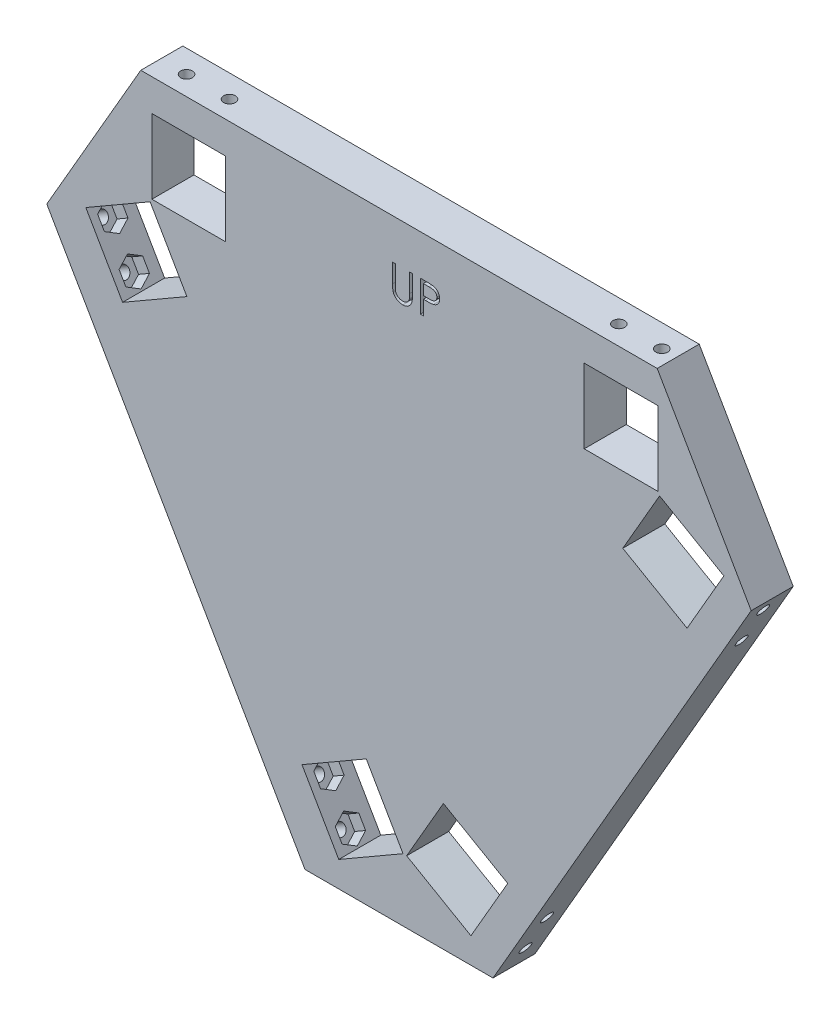
from build123d import *

# Parameters (mm, degrees)
RESSALTO_EXTRUS_O1_DEPTH = 10
ESBO_O2_R                = 1.4
CORTE_EXTRUS_O1_DEPTH    = 25
CORTE_EXTRUS_O2_START    = -7
ESBO_O2_4_R              = 1.4
CORTE_EXTRUS_O2_DEPTH    = 3
CORTE_EXTRUS_O4_START    = -10
ESBO_O2_6_W              = 10
ESBO_O2_6_H              = 7.5
ESBO_O2_6_R              = 1.4
ESBO_O2_6_H_2            = 2.5
CORTE_EXTRUS_O4_DEPTH    = 17.66
PADR_OCIRCULAR6_COUNT    = 3
CORTE_EXTRUS_O5_DEPTH    = 2


with BuildPart() as part:
    # Esboço1 → Ressalto-extrusão1 (new body)
    with BuildSketch(Plane.XY):
        Polygon((78.784620241, 13.891854213), (51.423008775, 61.28355545), (-51.423008775, 61.28355545), (-78.784620241, 13.891854213), (-27.361611466, -75.175409663), (27.361611466, -75.175409663), align=None)
        Polygon((-51.423008775, 61.28355545), (-61.423008775, 61.28355545), (-83.784620241, 22.552108251), (-78.784620241, 13.891854213), align=None)
        Polygon((78.784620241, 13.891854213), (51.423008775, 61.28355545), (61.423008775, 61.28355545), (83.784620241, 22.552108251), align=None)
        Polygon((-27.361611466, -75.175409663), (27.361611466, -75.175409663), (22.361611466, -83.835663701), (-22.361611466, -83.835663701), align=None)
    extrude(amount=RESSALTO_EXTRUS_O1_DEPTH)

    # Esboço2 → Corte-extrusão1 (cut)
    with BuildSketch(Plane(origin=(-53.073115854, -30.641777725, 0), x_dir=(0, 0, 1), z_dir=(-0.8660254037844384, -0.5000000000000006, 0))):
        with Locations(Location((5.4, 56.533008775, 0), (0, 0, 270))):
            Circle(ESBO_O2_R)
        with Locations(Location((5.4, 46.313008775, 0), (0, 0, 270))):
            Circle(ESBO_O2_R)
        with Locations(Location((5.4, -46.313008775, 0), (0, 0, 270))):
            Circle(ESBO_O2_R)
        with Locations(Location((5.4, -56.533008775, 0), (0, 0, 270))):
            Circle(ESBO_O2_R)
    corte_extrus_o1 = extrude(amount=-CORTE_EXTRUS_O1_DEPTH, mode=Mode.SUBTRACT)

    # Esboço2<4> → Corte-extrusão2 (cut)
    # profile 1 of 8: a face of its own
    with BuildSketch(Plane(origin=(-53.073115854, -30.641777725, 0), x_dir=(0, 0, 1), z_dir=(-0.8660254037844384, -0.5000000000000006, 0)).offset(CORTE_EXTRUS_O2_START)):
        Polygon((5.4, 53.299847267), (8.2, 54.916428021), (8.2, 58.149589529), (5.4, 59.766170282), (2.6, 58.149589529), (2.6, 54.916428021), align=None)
        with Locations(Location((5.4, 56.533008775, 0), (0, 0, 270))):
            Circle(ESBO_O2_4_R, mode=Mode.SUBTRACT)
    # profile 2 of 8: a face of its own
    with BuildSketch(Plane(origin=(-53.073115854, -30.641777725, 0), x_dir=(0, 0, 1), z_dir=(-0.8660254037844384, -0.5000000000000006, 0)).offset(CORTE_EXTRUS_O2_START)):
        Polygon((8.2, 44.696428021), (5.4, 43.079847267), (2.6, 44.696428021), (2.6, 47.929589529), (5.4, 49.546170282), (8.2, 47.929589529), align=None)
        with Locations(Location((5.4, 46.313008775, 0), (0, 0, 270))):
            Circle(ESBO_O2_4_R, mode=Mode.SUBTRACT)
    # profile 3 of 8: a face of its own
    with BuildSketch(Plane(origin=(-53.073115854, -30.641777725, 0), x_dir=(0, 0, 1), z_dir=(-0.8660254037844384, -0.5000000000000006, 0)).offset(CORTE_EXTRUS_O2_START)):
        Polygon((5.4, -49.546170282), (8.2, -47.929589529), (8.2, -44.696428021), (5.4, -43.079847267), (2.6, -44.696428021), (2.6, -47.929589529), align=None)
        with Locations(Location((5.4, -46.313008775, 0), (0, 0, 270))):
            Circle(ESBO_O2_4_R, mode=Mode.SUBTRACT)
    # profile 4 of 8: a face of its own
    with BuildSketch(Plane(origin=(-53.073115854, -30.641777725, 0), x_dir=(0, 0, 1), z_dir=(-0.8660254037844384, -0.5000000000000006, 0)).offset(CORTE_EXTRUS_O2_START)):
        with Locations(Location((5.4, -46.313008775, 0), (0, 0, 270))):
            Circle(ESBO_O2_4_R)
    # profile 5 of 8: a face of its own
    with BuildSketch(Plane(origin=(-53.073115854, -30.641777725, 0), x_dir=(0, 0, 1), z_dir=(-0.8660254037844384, -0.5000000000000006, 0)).offset(CORTE_EXTRUS_O2_START)):
        Polygon((8.2, -58.149589529), (5.4, -59.766170282), (2.6, -58.149589529), (2.6, -54.916428021), (5.4, -53.299847267), (8.2, -54.916428021), align=None)
        with Locations(Location((5.4, -56.533008775, 0), (0, 0, 270))):
            Circle(ESBO_O2_4_R, mode=Mode.SUBTRACT)
    # profile 6 of 8: a face of its own
    with BuildSketch(Plane(origin=(-53.073115854, -30.641777725, 0), x_dir=(0, 0, 1), z_dir=(-0.8660254037844384, -0.5000000000000006, 0)).offset(CORTE_EXTRUS_O2_START)):
        with Locations(Location((5.4, -56.533008775, 0), (0, 0, 270))):
            Circle(ESBO_O2_4_R)
    # profile 7 of 8: a face of its own
    with BuildSketch(Plane(origin=(-53.073115854, -30.641777725, 0), x_dir=(0, 0, 1), z_dir=(-0.8660254037844384, -0.5000000000000006, 0)).offset(CORTE_EXTRUS_O2_START)):
        with Locations(Location((5.4, 56.533008775, 0), (0, 0, 270))):
            Circle(ESBO_O2_4_R)
    # profile 8 of 8: a face of its own
    with BuildSketch(Plane(origin=(-53.073115854, -30.641777725, 0), x_dir=(0, 0, 1), z_dir=(-0.8660254037844384, -0.5000000000000006, 0)).offset(CORTE_EXTRUS_O2_START)):
        with Locations(Location((5.4, 46.313008775, 0), (0, 0, 270))):
            Circle(ESBO_O2_4_R)
    corte_extrus_o2 = extrude(amount=-CORTE_EXTRUS_O2_DEPTH, mode=Mode.SUBTRACT)

    # Esboço2<6> → Corte-extrusão4 (cut)
    # profile 1 of 14: a face of its own
    with BuildSketch(Plane(origin=(-53.073115854, -30.641777725, 0), x_dir=(0, 0, 1), z_dir=(-0.8660254037844384, -0.5000000000000006, 0)).offset(CORTE_EXTRUS_O4_START)):
        with Locations((5, 56.423008775)):
            Rectangle(ESBO_O2_6_W, ESBO_O2_6_H)
        Polygon((5.4, 59.766170282), (8.2, 58.149589529), (8.2, 54.916428021), (5.4, 53.299847267), (2.6, 54.916428021), (2.6, 58.149589529), align=None, mode=Mode.SUBTRACT)
    # profile 2 of 14: a face of its own
    with BuildSketch(Plane(origin=(-53.073115854, -30.641777725, 0), x_dir=(0, 0, 1), z_dir=(-0.8660254037844384, -0.5000000000000006, 0)).offset(CORTE_EXTRUS_O4_START)):
        with Locations((5, 46.423008775)):
            Rectangle(ESBO_O2_6_W, ESBO_O2_6_H)
        Polygon((5.4, 49.546170282), (8.2, 47.929589529), (8.2, 44.696428021), (5.4, 43.079847267), (2.6, 44.696428021), (2.6, 47.929589529), align=None, mode=Mode.SUBTRACT)
    # profile 3 of 14: a face of its own
    with BuildSketch(Plane(origin=(-53.073115854, -30.641777725, 0), x_dir=(0, 0, 1), z_dir=(-0.8660254037844384, -0.5000000000000006, 0)).offset(CORTE_EXTRUS_O4_START)):
        Polygon((5.4, 53.299847267), (8.2, 54.916428021), (8.2, 58.149589529), (5.4, 59.766170282), (2.6, 58.149589529), (2.6, 54.916428021), align=None)
        with Locations(Location((5.4, 56.533008775, 0), (0, 0, 270))):
            Circle(ESBO_O2_6_R, mode=Mode.SUBTRACT)
    # profile 4 of 14: a face of its own
    with BuildSketch(Plane(origin=(-53.073115854, -30.641777725, 0), x_dir=(0, 0, 1), z_dir=(-0.8660254037844384, -0.5000000000000006, 0)).offset(CORTE_EXTRUS_O4_START)):
        Polygon((8.2, 44.696428021), (5.4, 43.079847267), (2.6, 44.696428021), (2.6, 47.929589529), (5.4, 49.546170282), (8.2, 47.929589529), align=None)
        with Locations(Location((5.4, 46.313008775, 0), (0, 0, 270))):
            Circle(ESBO_O2_6_R, mode=Mode.SUBTRACT)
    # profile 5 of 14: a face of its own
    with BuildSketch(Plane(origin=(-53.073115854, -30.641777725, 0), x_dir=(0, 0, 1), z_dir=(-0.8660254037844384, -0.5000000000000006, 0)).offset(CORTE_EXTRUS_O4_START)):
        with Locations(Location((5.4, 46.313008775, 0), (0, 0, 270))):
            Circle(ESBO_O2_6_R)
    # profile 6 of 14: a face of its own
    with BuildSketch(Plane(origin=(-53.073115854, -30.641777725, 0), x_dir=(0, 0, 1), z_dir=(-0.8660254037844384, -0.5000000000000006, 0)).offset(CORTE_EXTRUS_O4_START)):
        with Locations(Location((5.4, 56.533008775, 0), (0, 0, 270))):
            Circle(ESBO_O2_6_R)
    # profile 7 of 14: a face of its own
    with BuildSketch(Plane(origin=(-53.073115854, -30.641777725, 0), x_dir=(0, 0, 1), z_dir=(-0.8660254037844384, -0.5000000000000006, 0)).offset(CORTE_EXTRUS_O4_START)):
        with Locations((5, -46.423008775)):
            Rectangle(ESBO_O2_6_W, ESBO_O2_6_H)
        Polygon((5.4, -43.079847267), (8.2, -44.696428021), (8.2, -47.929589529), (5.4, -49.546170282), (2.6, -47.929589529), (2.6, -44.696428021), align=None, mode=Mode.SUBTRACT)
    # profile 8 of 14: a face of its own
    with BuildSketch(Plane(origin=(-53.073115854, -30.641777725, 0), x_dir=(0, 0, 1), z_dir=(-0.8660254037844384, -0.5000000000000006, 0)).offset(CORTE_EXTRUS_O4_START)):
        Polygon((5.4, -49.546170282), (8.2, -47.929589529), (8.2, -44.696428021), (5.4, -43.079847267), (2.6, -44.696428021), (2.6, -47.929589529), align=None)
        with Locations(Location((5.4, -46.313008775, 0), (0, 0, 270))):
            Circle(ESBO_O2_6_R, mode=Mode.SUBTRACT)
    # profile 9 of 14: a face of its own
    with BuildSketch(Plane(origin=(-53.073115854, -30.641777725, 0), x_dir=(0, 0, 1), z_dir=(-0.8660254037844384, -0.5000000000000006, 0)).offset(CORTE_EXTRUS_O4_START)):
        with Locations(Location((5.4, -46.313008775, 0), (0, 0, 270))):
            Circle(ESBO_O2_6_R)
    # profile 10 of 14: a face of its own
    with BuildSketch(Plane(origin=(-53.073115854, -30.641777725, 0), x_dir=(0, 0, 1), z_dir=(-0.8660254037844384, -0.5000000000000006, 0)).offset(CORTE_EXTRUS_O4_START)):
        with Locations((5, -56.423008775)):
            Rectangle(ESBO_O2_6_W, ESBO_O2_6_H)
        Polygon((5.4, -53.299847267), (8.2, -54.916428021), (8.2, -58.149589529), (5.4, -59.766170282), (2.6, -58.149589529), (2.6, -54.916428021), align=None, mode=Mode.SUBTRACT)
    # profile 11 of 14: a face of its own
    with BuildSketch(Plane(origin=(-53.073115854, -30.641777725, 0), x_dir=(0, 0, 1), z_dir=(-0.8660254037844384, -0.5000000000000006, 0)).offset(CORTE_EXTRUS_O4_START)):
        Polygon((8.2, -58.149589529), (5.4, -59.766170282), (2.6, -58.149589529), (2.6, -54.916428021), (5.4, -53.299847267), (8.2, -54.916428021), align=None)
        with Locations(Location((5.4, -56.533008775, 0), (0, 0, 270))):
            Circle(ESBO_O2_6_R, mode=Mode.SUBTRACT)
    # profile 12 of 14: a face of its own
    with BuildSketch(Plane(origin=(-53.073115854, -30.641777725, 0), x_dir=(0, 0, 1), z_dir=(-0.8660254037844384, -0.5000000000000006, 0)).offset(CORTE_EXTRUS_O4_START)):
        with Locations(Location((5.4, -56.533008775, 0), (0, 0, 270))):
            Circle(ESBO_O2_6_R)
    # profile 13 of 14: a face of its own
    with BuildSketch(Plane(origin=(-53.073115854, -30.641777725, 0), x_dir=(0, 0, 1), z_dir=(-0.8660254037844384, -0.5000000000000006, 0)).offset(CORTE_EXTRUS_O4_START)):
        with Locations((5, 51.423008775)):
            Rectangle(ESBO_O2_6_W, ESBO_O2_6_H_2)
    # profile 14 of 14: a face of its own
    with BuildSketch(Plane(origin=(-53.073115854, -30.641777725, 0), x_dir=(0, 0, 1), z_dir=(-0.8660254037844384, -0.5000000000000006, 0)).offset(CORTE_EXTRUS_O4_START)):
        with Locations((5, -51.423008775)):
            Rectangle(ESBO_O2_6_W, ESBO_O2_6_H_2)
    corte_extrus_o4 = extrude(amount=-CORTE_EXTRUS_O4_DEPTH, mode=Mode.SUBTRACT)

    # PadrãoCircular6: Corte-extrusão1, Corte-extrusão2, Corte-extrusão4 ×3 about axis
    padr_ocircular6_axis = Axis((1.394284729, 0.804990664, 0), (0, 0, 1))
    add([corte_extrus_o1.rotate(padr_ocircular6_axis, i * 360 / PADR_OCIRCULAR6_COUNT) for i in range(1, PADR_OCIRCULAR6_COUNT)], mode=Mode.SUBTRACT)
    add([corte_extrus_o2.rotate(padr_ocircular6_axis, i * 360 / PADR_OCIRCULAR6_COUNT) for i in range(1, PADR_OCIRCULAR6_COUNT)], mode=Mode.SUBTRACT)
    add([corte_extrus_o4.rotate(padr_ocircular6_axis, i * 360 / PADR_OCIRCULAR6_COUNT) for i in range(1, PADR_OCIRCULAR6_COUNT)], mode=Mode.SUBTRACT)

    # Esboço3 → Corte-extrusão5 (cut)
    # profile 1 of 2: a face of its own
    with BuildSketch(Plane.XY.offset(10)):
        with BuildLine():
            Line((-1.52797783, 51.712311165), (-0.863127403, 51.712311165))
            Line((-0.863127403, 51.712311165), (-0.863127403, 47.273544138))
            add(Edge.make_bspline(
                [(-0.863127403, 47.273544138), (-0.863226344, 47.210719914), (-0.863414103, 47.091500122), (-0.862159948, 46.921810553), (-0.858647619, 46.770950515), (-0.856433248, 46.638338496), (-0.851507058, 46.524583014), (-0.847489526, 46.429067773), (-0.842323681, 46.352245044), (-0.836115249, 46.307412084), (-0.83344658, 46.288140826)],
                knots=[0, 0, 0, 0, 1.528628734, 2.90083645, 4.128790002, 5.200304208, 6.127813768, 6.898992206, 7.526736466, 8, 8, 8, 8], degree=3))
            add(Edge.make_bspline(
                [(-0.83344658, 46.288140826), (-0.822487626, 46.218615177), (-0.801187215, 46.0834814), (-0.746902382, 45.89105887), (-0.671088671, 45.717637284), (-0.581250898, 45.557805051), (-0.462860204, 45.416010905), (-0.321036054, 45.285387907), (-0.149209777, 45.171147587), (0.041841838, 45.066688369), (0.247762258, 44.982730611), (0.458182771, 44.919244657), (0.669940411, 44.880554319), (0.811706627, 44.876074311), (0.882104969, 44.873849627)],
                knots=[0, 0, 0, 0, 1.035780045, 2.013197591, 2.933192213, 3.817615948, 4.702609284, 5.640816605, 6.646850145, 7.73207398, 8.84249596, 9.914020372, 10.964143139, 12, 12, 12, 12], degree=3))
            add(Edge.make_bspline(
                [(0.882104969, 44.873849627), (0.942543719, 44.87612261), (1.063072142, 44.880655448), (1.242155754, 44.908725477), (1.416569317, 44.959315008), (1.587174089, 45.024592496), (1.74709034, 45.110841564), (1.896407292, 45.210474841), (2.029680953, 45.327337862), (2.151300382, 45.456666924), (2.257207662, 45.602589501), (2.349009912, 45.761928227), (2.424206463, 45.937081011), (2.461340257, 46.060174538), (2.480417268, 46.12341226)],
                knots=[0, 0, 0, 0, 0.994687771, 1.983630487, 2.973142513, 3.978332533, 4.983357753, 5.956394766, 6.925816176, 7.893390482, 8.871859704, 9.88551698, 10.913711441, 12, 12, 12, 12], degree=3))
            add(Edge.make_bspline(
                [(2.480417268, 46.12341226), (2.486767534, 46.149550076), (2.500918484, 46.207795663), (2.514141396, 46.306265728), (2.527913541, 46.422448215), (2.537469381, 46.557177885), (2.546785297, 46.710003277), (2.552358635, 46.881720522), (2.554934688, 47.071706089), (2.555702361, 47.204288082), (2.556103366, 47.273544138)],
                knots=[0, 0, 0, 0, 0.558680831, 1.244966039, 2.062412453, 2.990489873, 4.051219941, 5.244515665, 6.560634259, 8, 8, 8, 8], degree=3))
            Line((2.556103366, 47.273544138), (2.556103366, 51.712311165))
            Line((2.556103366, 51.712311165), (3.220953794, 51.712311165))
            Line((3.220953794, 51.712311165), (3.220953794, 47.237927151))
            add(Edge.make_bspline(
                [(3.220953794, 47.237927151), (3.220415905, 47.157285582), (3.219366184, 46.999908658), (3.210263297, 46.769294948), (3.195749314, 46.550531137), (3.175242861, 46.343587819), (3.148071205, 46.149205516), (3.117855321, 45.965680423), (3.079375309, 45.794329922), (3.034431277, 45.633817971), (2.983052267, 45.481025301), (2.916501836, 45.3360154), (2.841519978, 45.194379921), (2.752588963, 45.058261091), (2.652658203, 44.92705622), (2.539518812, 44.801561011), (2.416912671, 44.67977003), (2.282801604, 44.564807373), (2.139396325, 44.459379007), (1.987123415, 44.366673725), (1.827152585, 44.288307068), (1.659899668, 44.223799694), (1.485293289, 44.175297126), (1.303329044, 44.139154713), (1.113592752, 44.118618183), (0.984550896, 44.115566098), (0.919205997, 44.114020567)],
                knots=[0, 0, 0, 0, 1.316592851, 2.569410997, 3.76748051, 4.895814652, 5.963796859, 6.97159953, 7.931736103, 8.829262218, 9.692595152, 10.560224239, 11.431080259, 12.30701507, 13.211635791, 14.121146779, 15.063487852, 16.031507147, 17.00238618, 17.966455255, 18.938106653, 19.907068911, 20.888905087, 21.893141452, 22.933117798, 24, 24, 24, 24], degree=3))
            add(Edge.make_bspline(
                [(0.919205997, 44.114020567), (0.84793973, 44.115681653), (0.708115569, 44.118940699), (0.502083326, 44.13761552), (0.304568277, 44.172791121), (0.113484338, 44.217579669), (-0.068566981, 44.279351913), (-0.244024772, 44.351526277), (-0.40988398, 44.440166478), (-0.568835336, 44.53878916), (-0.71663107, 44.649754644), (-0.852303906, 44.770701346), (-0.976077832, 44.899691811), (-1.085866573, 45.038122585), (-1.183489112, 45.184917032), (-1.26758473, 45.340490423), (-1.339791097, 45.504782525), (-1.377058331, 45.618983466), (-1.39589817, 45.676715879)],
                knots=[0, 0, 0, 0, 1.13879206, 2.234305948, 3.301075583, 4.341971843, 5.366689343, 6.369221514, 7.369726634, 8.367512178, 9.355451585, 10.318319045, 11.268648973, 12.207971039, 13.137398894, 14.081662264, 15.030215811, 16, 16, 16, 16], degree=3))
            add(Edge.make_bspline(
                [(-1.39589817, 45.676715879), (-1.406856488, 45.716154829), (-1.430625324, 45.801698788), (-1.45607887, 45.943275189), (-1.477476427, 46.106290098), (-1.497596525, 46.290754673), (-1.509468819, 46.496811891), (-1.519877398, 46.724372429), (-1.528051158, 46.973711448), (-1.528002956, 47.147393506), (-1.52797783, 47.237927151)],
                knots=[0, 0, 0, 0, 0.625038921, 1.35572334, 2.194682327, 3.136881307, 4.189498639, 5.346923369, 6.617055217, 8, 8, 8, 8], degree=3))
            Line((-1.52797783, 47.237927151), (-1.52797783, 51.712311165))
        make_face()
    # profile 2 of 2: a face of its own
    with BuildSketch(Plane.XY.offset(10)):
        with BuildLine():
            Line((5.120526443, 51.712311165), (6.573402712, 51.712311165))
            add(Edge.make_bspline(
                [(6.573402712, 51.712311165), (6.673332463, 51.712201318), (6.864802305, 51.711990846), (7.139365839, 51.705609634), (7.388729771, 51.697086469), (7.612356411, 51.685271462), (7.810933818, 51.671308679), (7.983563436, 51.651725196), (8.131602163, 51.631277571), (8.220304148, 51.610488927), (8.26075748, 51.60100808)],
                knots=[0, 0, 0, 0, 1.415646017, 2.712440637, 3.8905458, 4.950247383, 5.884950622, 6.709939814, 7.411656543, 8, 8, 8, 8], degree=3))
            add(Edge.make_bspline(
                [(8.26075748, 51.60100808), (8.311967126, 51.58699162), (8.413179728, 51.559288979), (8.559020269, 51.503803264), (8.697775909, 51.438012682), (8.829922707, 51.363032009), (8.953836783, 51.275644231), (9.071366903, 51.17939174), (9.181475861, 51.072052254), (9.283544474, 50.954829688), (9.377280629, 50.82969191), (9.457988458, 50.694770857), (9.525567755, 50.552337598), (9.583529013, 50.402491206), (9.625245241, 50.243973354), (9.656671179, 50.07788548), (9.676617858, 49.904245385), (9.67852828, 49.785585332), (9.679500802, 49.725180089)],
                knots=[0, 0, 0, 0, 0.999701418, 1.975846123, 2.934577507, 3.890451536, 4.834027766, 5.787354733, 6.749476667, 7.726910423, 8.712836071, 9.690891519, 10.682875813, 11.679750201, 12.712814741, 13.765529915, 14.8625177, 16, 16, 16, 16], degree=3))
            add(Edge.make_bspline(
                [(9.679500802, 49.725180089), (9.678608786, 49.664267128), (9.676863498, 49.545086806), (9.65591636, 49.370731071), (9.627700788, 49.204110478), (9.584315361, 49.045594475), (9.527492019, 48.896124427), (9.460833841, 48.753416153), (9.380435368, 48.619897514), (9.288053812, 48.495083782), (9.18528627, 48.378857801), (9.072567551, 48.272061819), (8.950352716, 48.17532097), (8.819030169, 48.088418376), (8.677319655, 48.013369251), (8.52737043, 47.946149622), (8.367879139, 47.889695877), (8.257510818, 47.859998913), (8.201395834, 47.844899974)],
                knots=[0, 0, 0, 0, 1.121902311, 2.195077645, 3.232258892, 4.234102512, 5.217864754, 6.176164875, 7.132989551, 8.084763148, 9.034132444, 9.988522005, 10.94243251, 11.903244335, 12.886203696, 13.894208494, 14.929344452, 16, 16, 16, 16], degree=3))
            add(Edge.make_bspline(
                [(8.201395834, 47.844899974), (8.154982977, 47.835029997), (8.053266503, 47.81339937), (7.885747741, 47.789251469), (7.690706674, 47.768640215), (7.468409515, 47.75318614), (7.219055799, 47.739956193), (6.942510638, 47.729440395), (6.638231175, 47.723662204), (6.425990375, 47.723364193), (6.315179555, 47.723208601)],
                knots=[0, 0, 0, 0, 0.601384939, 1.31797006, 2.144135048, 3.087295005, 4.142315834, 5.309527816, 6.595305764, 8, 8, 8, 8], degree=3))
            Line((6.315179555, 47.723208601), (5.785376871, 47.723208601))
            Line((5.785376871, 47.723208601), (5.785376871, 44.303977832))
            Line((5.785376871, 44.303977832), (5.120526443, 44.303977832))
            Line((5.120526443, 44.303977832), (5.120526443, 51.712311165))
        make_face()
        with BuildLine():
            Line((5.785376871, 50.952482105), (5.785376871, 48.483037661))
            Line((5.785376871, 48.483037661), (7.08242882, 48.466713208))
            add(Edge.make_bspline(
                [(7.08242882, 48.466713208), (7.14575933, 48.466680477), (7.268017573, 48.46661729), (7.444624246, 48.47505268), (7.608473904, 48.484790474), (7.759063255, 48.499048179), (7.896460183, 48.519201507), (8.020893786, 48.539546352), (8.131399201, 48.56897937), (8.260725845, 48.608609866), (8.404835597, 48.676200569), (8.561611908, 48.774307837), (8.694476316, 48.899362002), (8.809450044, 49.039967579), (8.900690819, 49.196387402), (8.967484336, 49.363749985), (9.006729786, 49.540338933), (9.011992229, 49.661175494), (9.014650375, 49.722212007)],
                knots=[0, 0, 0, 0, 1.160613943, 2.240541288, 3.23993089, 4.169200891, 5.011653406, 5.7853311, 6.478053781, 7.106038997, 8.262395093, 9.384106736, 10.481365981, 11.59014053, 12.70357646, 13.786202915, 14.881775077, 16, 16, 16, 16], degree=3))
            add(Edge.make_bspline(
                [(9.014650375, 49.722212007), (9.011977773, 49.78177186), (9.006664972, 49.900169477), (8.967176728, 50.073691187), (8.90082068, 50.239290095), (8.808837555, 50.393749792), (8.697202163, 50.533849427), (8.567451887, 50.655551679), (8.419892151, 50.753387617), (8.282630062, 50.81653473), (8.160707551, 50.855090396), (8.054806569, 50.882066975), (7.935234642, 50.903605342), (7.801952842, 50.921045623), (7.65599421, 50.935975449), (7.496104777, 50.946105767), (7.322890232, 50.952035516), (7.20264119, 50.952329638), (7.140306424, 50.952482105)],
                knots=[0, 0, 0, 0, 1.120700087, 2.227813068, 3.331159281, 4.466773991, 5.599788987, 6.693661531, 7.80175334, 8.91857717, 9.525282508, 10.207424825, 10.974604443, 11.810962634, 12.737642355, 13.736264703, 14.826523623, 16, 16, 16, 16], degree=3))
            Line((7.140306424, 50.952482105), (5.785376871, 50.952482105))
        make_face(mode=Mode.SUBTRACT)
    extrude(amount=-CORTE_EXTRUS_O5_DEPTH, mode=Mode.SUBTRACT)


solid = part.part
